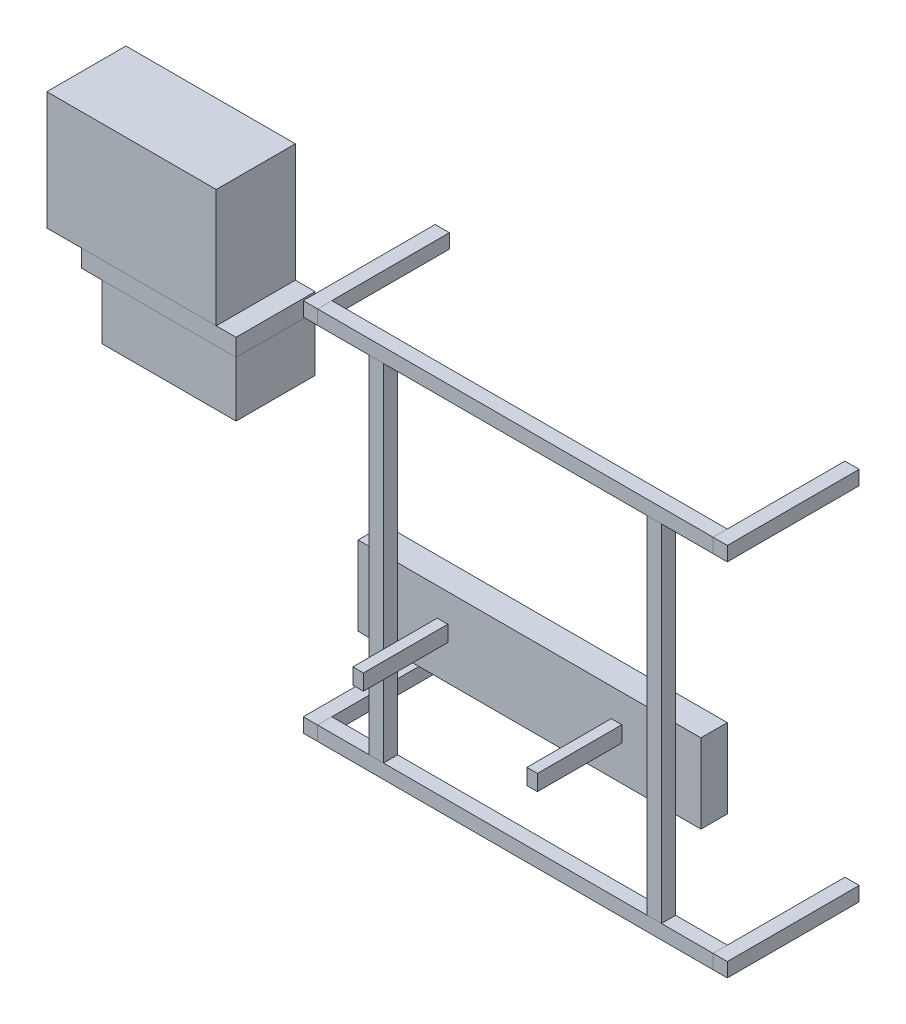
from build123d import *

# Parameters (mm, degrees)
SKETCH12_W             = 2926.3276029
SKETCH12_H             = 330.99849492
BOSS_EXTRUDE11_DEPTH   = 1500
SKETCH13_W             = 2542.6702565
SKETCH13_H             = 1045.654336
BOSS_EXTRUDE12_DEPTH   = 1500
SKETCH11_W             = 3212.18994
SKETCH11_H             = 2238.781009538
BOSS_EXTRUDE13_DEPTH   = 1500
SKETCH17_W             = 270
SKETCH17_H             = 270
BOSS_EXTRUDE17_DEPTH   = 2500
BOSS_EXTRUDE17_2_DEPTH = 2500
BOSS_EXTRUDE17_3_DEPTH = 2500
BOSS_EXTRUDE17_4_DEPTH = 2500
SKETCH19_W             = 270
SKETCH19_H             = 270
BOSS_EXTRUDE19_DEPTH   = 7500
BOSS_EXTRUDE19_2_DEPTH = 7500
SKETCH20_W             = 270
SKETCH20_H             = 270
BOSS_EXTRUDE20_DEPTH   = 6562.743389
BOSS_EXTRUDE20_2_DEPTH = 6562.743389
SKETCH21_W             = 6500
SKETCH21_H             = 1500
BOSS_EXTRUDE21_DEPTH   = 500
SKETCH23_W             = 200
SKETCH23_H             = 300
BOSS_EXTRUDE22_DEPTH   = 1600
BOSS_EXTRUDE22_2_DEPTH = 1600


with BuildPart() as part:
    # Sketch12 → Boss-Extrude11 (new body)
    with BuildSketch(Plane.XY):
        with Locations((-1589.412881329, -2404.280256998)):
            Rectangle(SKETCH12_W, SKETCH12_H)
    extrude(amount=BOSS_EXTRUDE11_DEPTH)


with BuildPart() as body_2:
    # Sketch13 → Boss-Extrude12 (new body)
    with BuildSketch(Plane.XY):
        with Locations((-1397.584208129, -3092.606672458)):
            Rectangle(SKETCH13_W, SKETCH13_H)
    extrude(amount=BOSS_EXTRUDE12_DEPTH)


with BuildPart() as body_3:
    # Sketch11 → Boss-Extrude13 (new body)
    with BuildSketch(Plane.XY):
        with Locations((-2108.478702879, -1119.390504769)):
            Rectangle(SKETCH11_W, SKETCH11_H)
    extrude(amount=BOSS_EXTRUDE13_DEPTH)


with BuildPart() as body_4:
    # Sketch17 → Boss-Extrude17 (new body)
    with BuildSketch(Plane.XY):
        with Locations((2282.962662868, -135)):
            Rectangle(SKETCH17_W, SKETCH17_H)
    extrude(amount=BOSS_EXTRUDE17_DEPTH)


with BuildPart() as body_5:
    # Sketch17 → Boss-Extrude17 2 (new body)
    with BuildSketch(Plane.XY):
        with Locations((10052.962662868, -135)):
            Rectangle(SKETCH17_W, SKETCH17_H)
    extrude(amount=BOSS_EXTRUDE17_2_DEPTH)


with BuildPart() as body_6:
    # Sketch17 → Boss-Extrude17 3 (new body)
    with BuildSketch(Plane.XY):
        with Locations((2282.962662868, -6967.743389)):
            Rectangle(SKETCH17_W, SKETCH17_H)
    extrude(amount=BOSS_EXTRUDE17_3_DEPTH)


with BuildPart() as body_7:
    # Sketch17 → Boss-Extrude17 4 (new body)
    with BuildSketch(Plane.XY):
        with Locations((10052.962662868, -6967.743389)):
            Rectangle(SKETCH17_W, SKETCH17_H)
    extrude(amount=BOSS_EXTRUDE17_4_DEPTH)


with BuildPart() as body_8:
    # Sketch19 → Boss-Extrude19 (new body)
    with BuildSketch(Plane.ZY.offset(-9917.962662868)):
        with Locations((2365, -135)):
            Rectangle(SKETCH19_W, SKETCH19_H)
    extrude(amount=BOSS_EXTRUDE19_DEPTH)


with BuildPart() as body_9:
    # Sketch19 → Boss-Extrude19 2 (new body)
    with BuildSketch(Plane.ZY.offset(-9917.962662868)):
        with Locations((2365, -6967.743389)):
            Rectangle(SKETCH19_W, SKETCH19_H)
    extrude(amount=BOSS_EXTRUDE19_2_DEPTH)


with BuildPart() as body_10:
    # Sketch20 → Boss-Extrude20 (new body)
    with BuildSketch(Plane.XZ.offset(270)):
        with Locations((8802.962662868, 2365)):
            Rectangle(SKETCH20_W, SKETCH20_H)
    extrude(amount=BOSS_EXTRUDE20_DEPTH)


with BuildPart() as body_11:
    # Sketch20 → Boss-Extrude20 2 (new body)
    with BuildSketch(Plane.XZ.offset(270)):
        with Locations((3532.962662868, 2365)):
            Rectangle(SKETCH20_W, SKETCH20_H)
    extrude(amount=BOSS_EXTRUDE20_2_DEPTH)


with BuildPart() as body_12:
    # Sketch21 → Boss-Extrude21 (new body)
    with BuildSketch(Plane(origin=(0, 0, 2230), x_dir=(-1, 0, 0), z_dir=(0, 0, -1))):
        with Locations((-6167.119776447, -4429.7525618)):
            Rectangle(SKETCH21_W, SKETCH21_H)
    extrude(amount=BOSS_EXTRUDE21_DEPTH)


with BuildPart() as body_13:
    # Sketch23 → Boss-Extrude22 (new body)
    with BuildSketch(Plane.XY.offset(2230)):
        with Locations((4517.962662868, -4363.704249905)):
            Rectangle(SKETCH23_W, SKETCH23_H)
    extrude(amount=BOSS_EXTRUDE22_DEPTH)


with BuildPart() as body_14:
    # Sketch23 → Boss-Extrude22 2 (new body)
    with BuildSketch(Plane.XY.offset(2230)):
        with Locations((7817.962662868, -4363.704249905)):
            Rectangle(SKETCH23_W, SKETCH23_H)
    extrude(amount=BOSS_EXTRUDE22_2_DEPTH)


solid = Compound([part.part, body_2.part, body_3.part, body_4.part, body_5.part, body_6.part, body_7.part, body_8.part, body_9.part, body_10.part, body_11.part, body_12.part, body_13.part, body_14.part])
